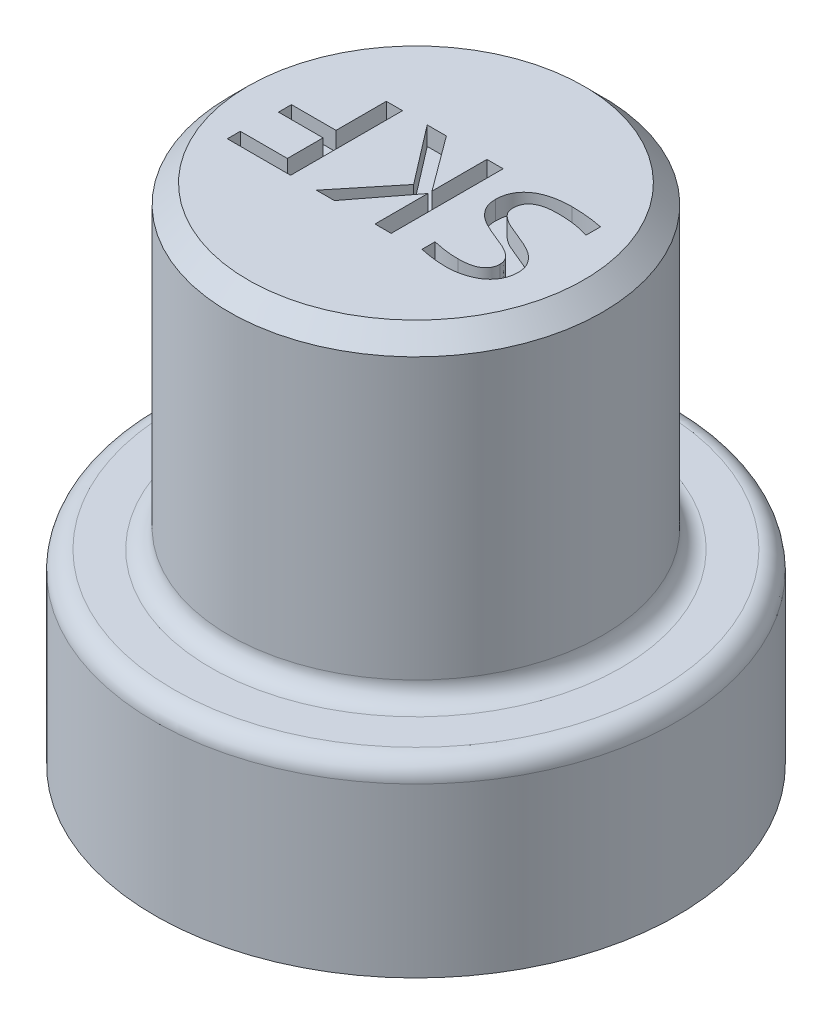
from build123d import *

# Parameters (mm, degrees)
CHAMFER1_SIZE      = 1
FILLET1_R          = 1
FILLET2_R          = 1
CUT_EXTRUDE1_DEPTH = 1


with BuildPart() as part:
    # Sketch1 → Revolve1 (revolve)
    with BuildSketch(Plane(origin=(0, 0, 0), x_dir=(0, 1, 0), z_dir=(0, 0, 1))):
        Polygon((0, 14), (10, 14), (10, 10), (27, 10), (27, 0), (0, 0), align=None)
    revolve(axis=Axis((0, 27, 0), (0, -1, 0)))

    # Chamfer1
    chamfer1_edges = [part.edges().sort_by_distance(p)[0] for p in [
        (10, 27, 0),
    ]]
    chamfer(chamfer1_edges, length=CHAMFER1_SIZE)

    # Fillet1
    fillet1_edges = [part.edges().sort_by_distance(p)[0] for p in [
        (10, 10, 0),
    ]]
    fillet(fillet1_edges, radius=FILLET1_R)

    # Fillet2
    fillet2_edges = [part.edges().sort_by_distance(p)[0] for p in [
        (14, 10, 0),
    ]]
    fillet(fillet2_edges, radius=FILLET2_R)

    # Sketch2 → Cut-Extrude1 (cut)
    with BuildSketch(Plane(origin=(0, 27, 0), x_dir=(-1, 0, 0), z_dir=(0, 1, 0))):
        with BuildLine():
            add(Edge.make_bspline(
                [(-2.891304348, -1.376358696), (-2.893256975, -1.445784768), (-2.89704504, -1.580470179), (-2.930373434, -1.776453017), (-2.985954677, -1.958491369), (-3.06233216, -2.127831325), (-3.160586384, -2.281397406), (-3.272814945, -2.424730968), (-3.406825247, -2.550807782), (-3.555286262, -2.665606611), (-3.720516873, -2.766637543), (-3.902939881, -2.851664305), (-4.1000545, -2.925119751), (-4.312408375, -2.984347065), (-4.538102751, -3.030388297), (-4.776023597, -3.062017105), (-5.024975551, -3.08336435), (-5.19470001, -3.08574336), (-5.28125, -3.086956522)],
                knots=[0, 0, 0, 0, 1.005643061, 1.95093061, 2.870738502, 3.757832008, 4.633806625, 5.507195241, 6.389247641, 7.292512577, 8.223494331, 9.189475669, 10.205094408, 11.269007441, 12.381228937, 13.540657028, 14.745872513, 16, 16, 16, 16], degree=3))
            add(Edge.make_bspline(
                [(-5.28125, -3.086956522), (-5.360971004, -3.086063288), (-5.520031312, -3.084281097), (-5.75656703, -3.073355487), (-5.987975241, -3.055306767), (-6.21079801, -3.033603304), (-6.423346627, -3.009477077), (-6.622805279, -2.981574567), (-6.806658039, -2.949130506), (-6.923064215, -2.924650998), (-6.97826087, -2.913043478)],
                knots=[0, 0, 0, 0, 1.119729043, 2.234096861, 3.324996266, 4.379512959, 5.378439906, 6.329323539, 7.207810484, 8, 8, 8, 8], degree=3))
            Line((-6.97826087, -2.913043478), (-6.97826087, -2.130434783))
            add(Edge.make_bspline(
                [(-6.97826087, -2.130434783), (-6.919165793, -2.150682551), (-6.798419665, -2.192053842), (-6.609018112, -2.240578611), (-6.41034209, -2.286150871), (-6.20050371, -2.324223656), (-5.977458635, -2.354188802), (-5.74035588, -2.375262926), (-5.488398941, -2.389534151), (-5.315691279, -2.390703292), (-5.226902174, -2.391304348)],
                knots=[0, 0, 0, 0, 0.842364813, 1.72116351, 2.635659137, 3.591954833, 4.596841017, 5.670471508, 6.802388115, 8, 8, 8, 8], degree=3))
            add(Edge.make_bspline(
                [(-5.226902174, -2.391304348), (-5.163466632, -2.390651338), (-5.041451136, -2.389395301), (-4.865633018, -2.376263738), (-4.704182749, -2.3591435), (-4.557448129, -2.32940707), (-4.423956498, -2.295180195), (-4.303296886, -2.251625304), (-4.19565966, -2.199792452), (-4.099167106, -2.141685494), (-4.01647088, -2.074548109), (-3.943968157, -2.002194202), (-3.885784495, -1.921479924), (-3.838521468, -1.83432077), (-3.803582408, -1.740421984), (-3.779319418, -1.640031503), (-3.764056478, -1.533525867), (-3.761950623, -1.46019787), (-3.760869565, -1.422554348)],
                knots=[0, 0, 0, 0, 1.523194236, 2.929797672, 4.233142745, 5.41923506, 6.522104548, 7.540643951, 8.494207191, 9.387815665, 10.238903194, 11.04655015, 11.840679357, 12.619387111, 13.4214478, 14.239285369, 15.096122854, 16, 16, 16, 16], degree=3))
            add(Edge.make_bspline(
                [(-3.760869565, -1.422554348), (-3.762218701, -1.383440778), (-3.764854628, -1.307021088), (-3.791778823, -1.197385593), (-3.833874612, -1.095715968), (-3.895589177, -1.005041856), (-3.968114472, -0.919845819), (-4.053315168, -0.841779159), (-4.147364807, -0.766290328), (-4.290070482, -0.671359764), (-4.489755312, -0.559812554), (-4.755758112, -0.448263589), (-5.037837792, -0.336261682), (-5.327327353, -0.219443132), (-5.616743105, -0.095439779), (-5.900671358, 0.035928527), (-6.166963577, 0.186635246), (-6.367486356, 0.3361767), (-6.50758604, 0.470833926), (-6.602897854, 0.578652807), (-6.684679481, 0.696390124), (-6.760227351, 0.81988187), (-6.819332991, 0.95635363), (-6.860340608, 1.104522993), (-6.887554703, 1.264408532), (-6.890025412, 1.374880549), (-6.891304348, 1.432065217)],
                knots=[0, 0, 0, 0, 0.619815692, 1.2109895, 1.781199776, 2.357496674, 2.943929778, 3.554333405, 4.188738872, 4.856760597, 6.272963823, 7.811824644, 9.431291666, 11.092170587, 12.76691914, 14.429617761, 16.056218893, 17.616396577, 18.384212937, 19.138341755, 19.896401647, 20.65718422, 21.4332038, 22.247956952, 23.09307348, 24, 24, 24, 24], degree=3))
            add(Edge.make_bspline(
                [(-6.891304348, 1.432065217), (-6.889745465, 1.483341333), (-6.886623871, 1.586019546), (-6.860837557, 1.739445048), (-6.820282244, 1.891529982), (-6.763187009, 2.041721189), (-6.688399481, 2.186542657), (-6.59738111, 2.325382168), (-6.485582972, 2.453213148), (-6.357387336, 2.573747467), (-6.209075999, 2.684028027), (-6.042502613, 2.784628777), (-5.85495723, 2.870963409), (-5.650029948, 2.949309849), (-5.423589443, 3.011500607), (-5.17675842, 3.056055567), (-4.909488573, 3.08120208), (-4.72469023, 3.084994391), (-4.629076087, 3.086956522)],
                knots=[0, 0, 0, 0, 0.784067079, 1.570060577, 2.373452904, 3.189297991, 4.022898002, 4.862695015, 5.722463422, 6.614650011, 7.550049647, 8.544652583, 9.586108202, 10.704431291, 11.897970904, 13.172772987, 14.537200697, 16, 16, 16, 16], degree=3))
            add(Edge.make_bspline(
                [(-4.629076087, 3.086956522), (-4.575613848, 3.086610144), (-4.464505975, 3.085890284), (-4.293308173, 3.073583281), (-4.114746578, 3.058061805), (-3.933177649, 3.035827154), (-3.751912041, 3.010443569), (-3.57395579, 2.980516606), (-3.403125456, 2.948575486), (-3.292522299, 2.924611635), (-3.239130435, 2.913043478)],
                knots=[0, 0, 0, 0, 0.91416123, 1.89985515, 2.934260182, 3.979599391, 5.027947684, 6.064525625, 7.065681407, 8, 8, 8, 8], degree=3))
            Line((-3.239130435, 2.913043478), (-3.239130435, 2.217391304))
            add(Edge.make_bspline(
                [(-3.239130435, 2.217391304), (-3.357971402, 2.243749443), (-3.594474622, 2.29620429), (-3.950412242, 2.348530566), (-4.299963453, 2.385175658), (-4.530706874, 2.389285877), (-4.644021739, 2.391304348)],
                knots=[0, 0, 0, 0, 1.029411825, 2.048613503, 3.041701399, 4, 4, 4, 4], degree=3))
            add(Edge.make_bspline(
                [(-4.644021739, 2.391304348), (-4.701101178, 2.390431872), (-4.811743494, 2.388740672), (-4.971923163, 2.378342646), (-5.120237405, 2.359301917), (-5.256836907, 2.3335494), (-5.382099169, 2.301680277), (-5.495638683, 2.261191945), (-5.596829934, 2.211770598), (-5.6873755, 2.15624259), (-5.765945999, 2.093381994), (-5.835015926, 2.026647347), (-5.892681803, 1.954080686), (-5.939230398, 1.875694945), (-5.97565839, 1.792532309), (-6.003949196, 1.70494053), (-6.018307856, 1.61143275), (-6.020578052, 1.547595053), (-6.02173913, 1.514945652)],
                knots=[0, 0, 0, 0, 1.491437277, 2.890989782, 4.191431573, 5.395946596, 6.521058188, 7.565423013, 8.539223212, 9.458660202, 10.334655275, 11.163081303, 11.963306063, 12.748694206, 13.538083787, 14.331542868, 15.146677777, 16, 16, 16, 16], degree=3))
            add(Edge.make_bspline(
                [(-6.02173913, 1.514945652), (-6.020391512, 1.475835905), (-6.017758549, 1.399423684), (-5.990712947, 1.289326834), (-5.948392096, 1.187371322), (-5.889221823, 1.093867016), (-5.813847439, 1.010530917), (-5.730887666, 0.929467142), (-5.636504976, 0.853417269), (-5.494079004, 0.756044238), (-5.292632358, 0.645078177), (-5.027933357, 0.528654214), (-4.744289363, 0.419843921), (-4.455483254, 0.301879764), (-4.165028382, 0.179166441), (-3.928307462, 0.065008), (-3.744588107, -0.032987708), (-3.61583947, -0.115137783), (-3.493592228, -0.201779371), (-3.381185761, -0.297499604), (-3.27569995, -0.398738791), (-3.181404108, -0.510019231), (-3.097288568, -0.628917616), (-3.02475958, -0.756630047), (-2.962723179, -0.893416032), (-2.922268905, -1.043906372), (-2.895043236, -1.205985193), (-2.892579233, -1.318264769), (-2.891304348, -1.376358696)],
                knots=[0, 0, 0, 0, 0.667485538, 1.304126353, 1.925325377, 2.548259058, 3.18485279, 3.841928735, 4.529978862, 5.253739616, 6.789399884, 8.452896455, 10.194043647, 11.982660287, 13.786213269, 15.583473082, 16.473910229, 17.343881083, 18.192645259, 19.033319022, 19.865571682, 20.689426309, 21.522902605, 22.351690537, 23.197589349, 24.082454772, 25.007853999, 26, 26, 26, 26], degree=3))
        make_face()
        Polygon((2.39673913, -3), (1.369565217, -3), (-0.804347826, -0.057065217), (-0.804347826, -3), (-1.673913043, -3), (-1.673913043, 3), (-0.804347826, 3), (-0.804347826, 0.169836957), (1.369565217, 3), (2.336956522, 3), (-0.005434783, 0.127717391), align=None)
        Polygon((7.108695652, 2.304347826), (4.586956522, 2.304347826), (4.586956522, 0.391304348), (6.975543478, 0.391304348), (6.975543478, -0.304347826), (4.586956522, -0.304347826), (4.586956522, -3), (3.717391304, -3), (3.717391304, 3), (7.108695652, 3), align=None)
    extrude(amount=-CUT_EXTRUDE1_DEPTH, mode=Mode.SUBTRACT)


solid = part.part
